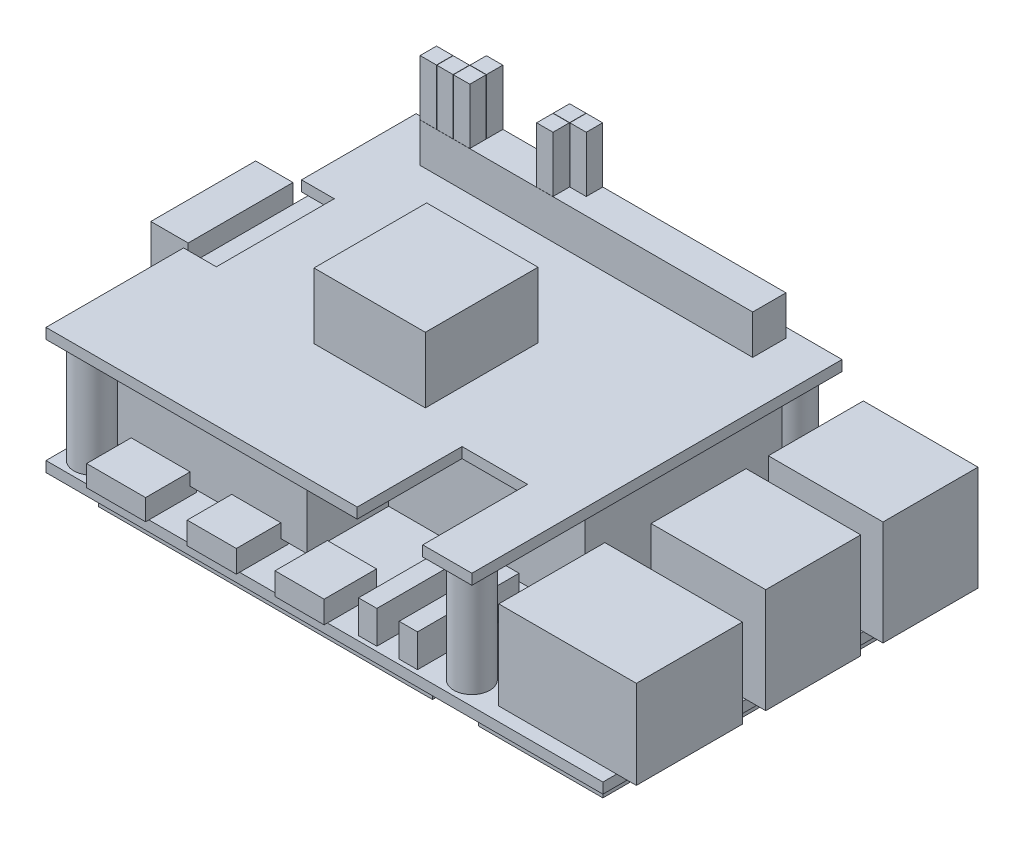
from build123d import *

# Parameters (mm, degrees)
SKETCH1_W                                 = 85
SKETCH1_H                                 = 56
PI_5_PCB_DEPTH                            = 1.6
SKETCH2_W                                 = 51
SKETCH2_H                                 = 54
UNDERSIDE_PARTS_1_DEPTH                   = 1.5
SKETCH3_W                                 = 83
SKETCH3_H                                 = 42
UNDERSIDE_PARTS_2_DEPTH                   = 1.5
SKETCH4_W                                 = 19
SKETCH4_H                                 = 54
UNDERSIDE_PARTS_3_DEPTH                   = 1.5
SKETCH5_W                                 = 16.5
SKETCH5_H                                 = 12
MICROSD_CARD_DEPTH                        = 1.5
SKETCH6_W                                 = 33.5
SKETCH6_H                                 = 42.5
COOLER_FINS_DEPTH                         = 13.7
SKETCH7_W                                 = 30
SKETCH7_H                                 = 30
COOLER_FAN_DEPTH                          = 13.7
SKETCH8_W                                 = 50.8
SKETCH8_H                                 = 5.08
F_40_PIN_HEADER_AND_STACKING_SOCKET_DEPTH = 16
SKETCH9_R                                 = 2.75
HAT_SPACER_1_DEPTH                        = 16
SKETCH10_R                                = 2.75
HAT_SPACER_2_DEPTH                        = 16
SKETCH11_R                                = 2.75
HAT_SPACER_3_DEPTH                        = 16
SKETCH12_R                                = 2.75
HAT_SPACER_4_DEPTH                        = 16
AI_HAT_PCB_DEPTH                          = 1.6
SKETCH14_W                                = 17
SKETCH14_H                                = 17.2
HAILO_AND_HEATSINK_DEPTH                  = 10
SKETCH15_W                                = 50.8
SKETCH15_H                                = 5.08
STACKING_PINS_DEPTH                       = 6
SKETCH16_W                                = 2.5
SKETCH16_H                                = 2.5
DUPONT_HOUSINGS_DEPTH                     = 14
SKETCH17_W                                = 5.7
SKETCH17_H                                = 16
PCIE_FLAT_CABLE_LOOP_DEPTH                = 18.6
SKETCH18_W                                = 21
SKETCH18_H                                = 16.2
ETHERNET_DEPTH                            = 13.5
SKETCH19_W                                = 17.5
SKETCH19_H                                = 14.5
USB_A_STACKS_DEPTH                        = 16
SKETCH20_W                                = 9
SKETCH20_H                                = 7.8
USB_C_DEPTH                               = 3.2
SKETCH21_W                                = 7.5
SKETCH21_H                                = 8
MICRO_HDMI_DEPTH                          = 3.4
SKETCH22_W                                = 2.8
SKETCH22_H                                = 15.5
CAM_DISP_CONNECTORS_DEPTH                 = 5


with BuildPart() as part:
    # Sketch1 → Pi 5 PCB (new body)
    with BuildSketch(Plane(origin=(0, -18, 0), x_dir=(1, 0, 0), z_dir=(0, 1, 0))):
        with Locations((-12.5, -64.5)):
            Rectangle(SKETCH1_W, SKETCH1_H)
    extrude(amount=PI_5_PCB_DEPTH)

    # Sketch2 → Underside Parts 1 (add)
    with BuildSketch(Plane(origin=(0, -19.5, 0), x_dir=(1, 0, 0), z_dir=(0, 1, 0))):
        with Locations((-22.5, -64.5)):
            Rectangle(SKETCH2_W, SKETCH2_H)
    extrude(amount=UNDERSIDE_PARTS_1_DEPTH)

    # Sketch3 → Underside Parts 2 (add)
    with BuildSketch(Plane(origin=(0, -19.5, 0), x_dir=(1, 0, 0), z_dir=(0, 1, 0))):
        with Locations((-12.5, -64.5)):
            Rectangle(SKETCH3_W, SKETCH3_H)
    extrude(amount=UNDERSIDE_PARTS_2_DEPTH)

    # Sketch4 → Underside Parts 3 (add)
    with BuildSketch(Plane(origin=(0, -19.5, 0), x_dir=(1, 0, 0), z_dir=(0, 1, 0))):
        with Locations((19.5, -64.5)):
            Rectangle(SKETCH4_W, SKETCH4_H)
    extrude(amount=UNDERSIDE_PARTS_3_DEPTH)

    # Sketch5 → microSD Card (add)
    with BuildSketch(Plane(origin=(0, -19.5, 0), x_dir=(1, 0, 0), z_dir=(0, 1, 0))):
        with Locations((-49.25, -64.5)):
            Rectangle(SKETCH5_W, SKETCH5_H)
    extrude(amount=MICROSD_CARD_DEPTH)

    # Sketch8 → 40-pin Header And Stacking Socket (add)
    with BuildSketch(Plane(origin=(0, -16.4, 0), x_dir=(1, 0, 0), z_dir=(0, 1, 0))):
        with Locations((-22.5, -40)):
            Rectangle(SKETCH8_W, SKETCH8_H)
    extrude(amount=F_40_PIN_HEADER_AND_STACKING_SOCKET_DEPTH)

    # Sketch9 → HAT Spacer 1 (add)
    with BuildSketch(Plane(origin=(0, -16.4, 0), x_dir=(1, 0, 0), z_dir=(0, 1, 0))):
        with Locations(Location((-51.5, -89, 0), (0, 0, 270))):
            Circle(SKETCH9_R)
    extrude(amount=HAT_SPACER_1_DEPTH)

    # Sketch10 → HAT Spacer 2 (add)
    with BuildSketch(Plane(origin=(0, -16.4, 0), x_dir=(1, 0, 0), z_dir=(0, 1, 0))):
        with Locations(Location((6.5, -89, 0), (0, 0, 270))):
            Circle(SKETCH10_R)
    extrude(amount=HAT_SPACER_2_DEPTH)

    # Sketch11 → HAT Spacer 3 (add)
    with BuildSketch(Plane(origin=(0, -16.4, 0), x_dir=(1, 0, 0), z_dir=(0, 1, 0))):
        with Locations(Location((-51.5, -40, 0), (0, 0, 270))):
            Circle(SKETCH11_R)
    extrude(amount=HAT_SPACER_3_DEPTH)

    # Sketch12 → HAT Spacer 4 (add)
    with BuildSketch(Plane(origin=(0, -16.4, 0), x_dir=(1, 0, 0), z_dir=(0, 1, 0))):
        with Locations(Location((6.5, -40, 0), (0, 0, 270))):
            Circle(SKETCH12_R)
    extrude(amount=HAT_SPACER_4_DEPTH)

    # Sketch13 → AI HAT+ PCB (add)
    with BuildSketch(Plane(origin=(0, -0.4, 0), x_dir=(1, 0, 0), z_dir=(0, 1, 0))):
        Polygon((-55, -92.5), (-7.5, -92.5), (-7.5, -76.5), (2.5, -76.5), (2.5, -92.5), (10, -92.5), (10, -36), (-55, -36), (-55, -53.5), (-50, -53.5), (-50, -71.5), (-55, -71.5), align=None)
    extrude(amount=AI_HAT_PCB_DEPTH)

    # Sketch14 → Hailo And Heatsink (add)
    with BuildSketch(Plane(origin=(0, 1.2, 0), x_dir=(1, 0, 0), z_dir=(0, 1, 0))):
        with Locations((-23.9, -65.6)):
            Rectangle(SKETCH14_W, SKETCH14_H)
    extrude(amount=HAILO_AND_HEATSINK_DEPTH)

    # Sketch15 → Stacking Pins (add)
    with BuildSketch(Plane(origin=(0, 1.2, 0), x_dir=(1, 0, 0), z_dir=(0, 1, 0))):
        with Locations((-22.5, -40)):
            Rectangle(SKETCH15_W, SKETCH15_H)
    extrude(amount=STACKING_PINS_DEPTH)

    # Sketch16 → Dupont Housings (add)
    with BuildSketch(Plane(origin=(0, 1.7, 0), x_dir=(1, 0, 0), z_dir=(0, 1, 0))):
        with Locations((-46.63, -41.27)):
            Rectangle(SKETCH16_W, SKETCH16_H)
        with Locations((-44.09, -41.27)):
            Rectangle(SKETCH16_W, SKETCH16_H)
        with Locations((-41.55, -41.27)):
            Rectangle(SKETCH16_W, SKETCH16_H)
        with Locations((-41.55, -38.73)):
            Rectangle(SKETCH16_W, SKETCH16_H)
        with Locations((-28.85, -41.27)):
            Rectangle(SKETCH16_W, SKETCH16_H)
        with Locations((-28.85, -38.73)):
            Rectangle(SKETCH16_W, SKETCH16_H)
        with Locations((-26.31, -38.73)):
            Rectangle(SKETCH16_W, SKETCH16_H)
    extrude(amount=DUPONT_HOUSINGS_DEPTH)

    # Sketch18 → Ethernet (add)
    with BuildSketch(Plane(origin=(0, -16.4, 0), x_dir=(1, 0, 0), z_dir=(0, 1, 0))):
        with Locations((22.5, -82.3)):
            Rectangle(SKETCH18_W, SKETCH18_H)
    extrude(amount=ETHERNET_DEPTH)

    # Sketch19 → USB-A Stacks (add)
    with BuildSketch(Plane(origin=(0, -16.4, 0), x_dir=(1, 0, 0), z_dir=(0, 1, 0))):
        with Locations((24.25, -63.4)):
            Rectangle(SKETCH19_W, SKETCH19_H)
        with Locations((24.25, -45.5)):
            Rectangle(SKETCH19_W, SKETCH19_H)
    extrude(amount=USB_A_STACKS_DEPTH)



with BuildPart() as body_2:
    # Sketch6 → Cooler Fins (new body)
    with BuildSketch(Plane(origin=(0, -15.1, 0), x_dir=(1, 0, 0), z_dir=(0, 1, 0))):
        with Locations((-38.25, -64.95)):
            Rectangle(SKETCH6_W, SKETCH6_H)
    extrude(amount=COOLER_FINS_DEPTH)

    # Sketch7 → Cooler Fan (add)
    with BuildSketch(Plane(origin=(0, -15.1, 0), x_dir=(1, 0, 0), z_dir=(0, 1, 0))):
        with Locations((-6.5, -58.7)):
            Rectangle(SKETCH7_W, SKETCH7_H)
    extrude(amount=COOLER_FAN_DEPTH)


with BuildPart() as body_3:
    # Sketch17 → PCIe Flat Cable Loop (new body)
    with BuildSketch(Plane(origin=(0, -17.4, 0), x_dir=(1, 0, 0), z_dir=(0, 1, 0))):
        with Locations((-58.15, -62.5)):
            Rectangle(SKETCH17_W, SKETCH17_H)
    extrude(amount=PCIE_FLAT_CABLE_LOOP_DEPTH)


with BuildPart() as part_1:
    add(part.part)

    add(body_2.part)  # USB-C merges body 2
    # Sketch20 → USB-C (add)
    with BuildSketch(Plane(origin=(0, -16.4, 0), x_dir=(1, 0, 0), z_dir=(0, 1, 0))):
        with Locations((-43.8, -89.1)):
            Rectangle(SKETCH20_W, SKETCH20_H)
    extrude(amount=USB_C_DEPTH)

    # Sketch21 → Micro-HDMI (add)
    with BuildSketch(Plane(origin=(0, -16.4, 0), x_dir=(1, 0, 0), z_dir=(0, 1, 0))):
        with Locations((-29.2, -89)):
            Rectangle(SKETCH21_W, SKETCH21_H)
        with Locations((-15.8, -89)):
            Rectangle(SKETCH21_W, SKETCH21_H)
    extrude(amount=MICRO_HDMI_DEPTH)

    # Sketch22 → CAM-DISP Connectors (add)
    with BuildSketch(Plane(origin=(0, -16.4, 0), x_dir=(1, 0, 0), z_dir=(0, 1, 0))):
        with Locations((-6.6, -84.05)):
            Rectangle(SKETCH22_W, SKETCH22_H)
        with Locations((-0.4, -84.05)):
            Rectangle(SKETCH22_W, SKETCH22_H)
    extrude(amount=CAM_DISP_CONNECTORS_DEPTH)


solid = Compound([body_3.part, part_1.part])
